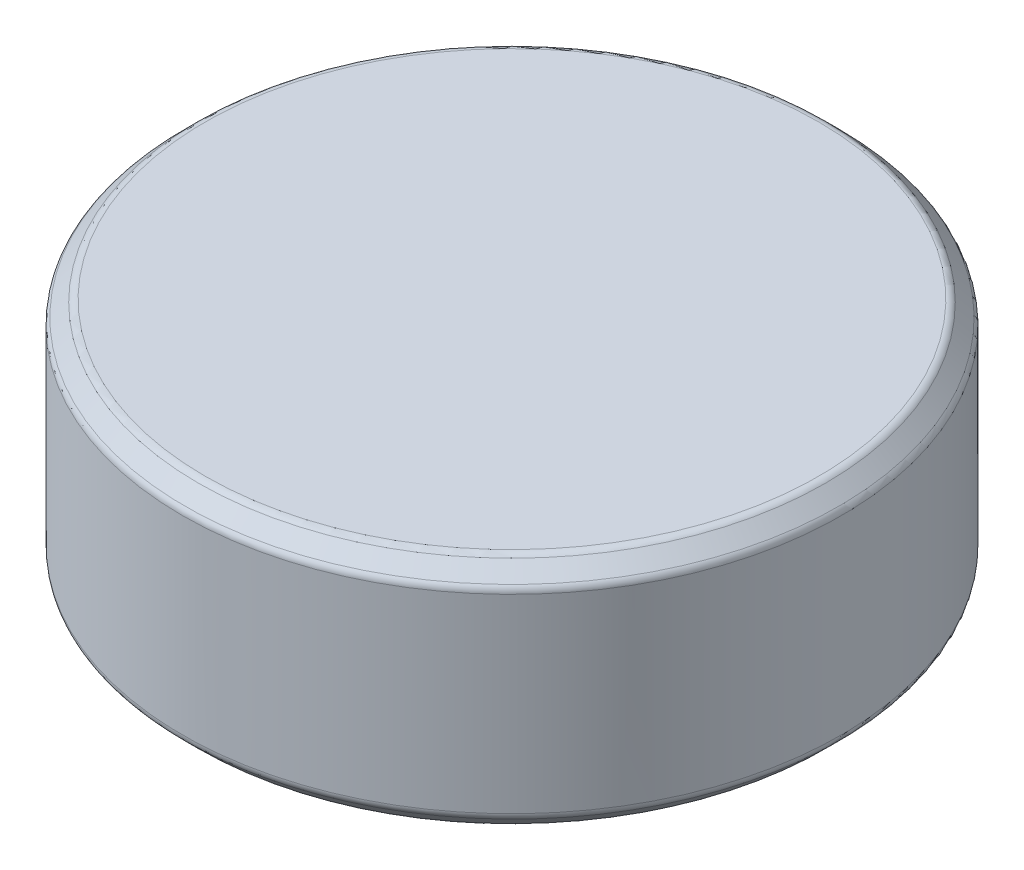
from build123d import *

# Parameters (mm, degrees)
SKETCH1_R           = 35
BOSS_EXTRUDE1_DEPTH = 25
CHAMFER1_SIZE       = 2
FILLET2_R           = 1


with BuildPart() as part:
    # Sketch1 → Boss-Extrude1 (new body)
    with BuildSketch(Plane(origin=(0, 0, 0), x_dir=(1, 0, 0), z_dir=(0, 1, 0))):
        with Locations(Location((0, 0, 0), (0, 0, 270))):
            Circle(SKETCH1_R)
    extrude(amount=BOSS_EXTRUDE1_DEPTH)

    # Chamfer1
    chamfer1_edges = [part.edges().sort_by_distance(p)[0] for p in [
        (0, 0, -35),
        (0, 25, -35),
    ]]
    chamfer(chamfer1_edges, length=CHAMFER1_SIZE)

    # Fillet2
    fillet2_edges = [part.edges().sort_by_distance(p)[0] for p in [
        (0, 23, -35),
        (0, 2, -35),
        (0, 0, -33),
        (0, 25, -33),
    ]]
    fillet(fillet2_edges, radius=FILLET2_R)


solid = part.part
